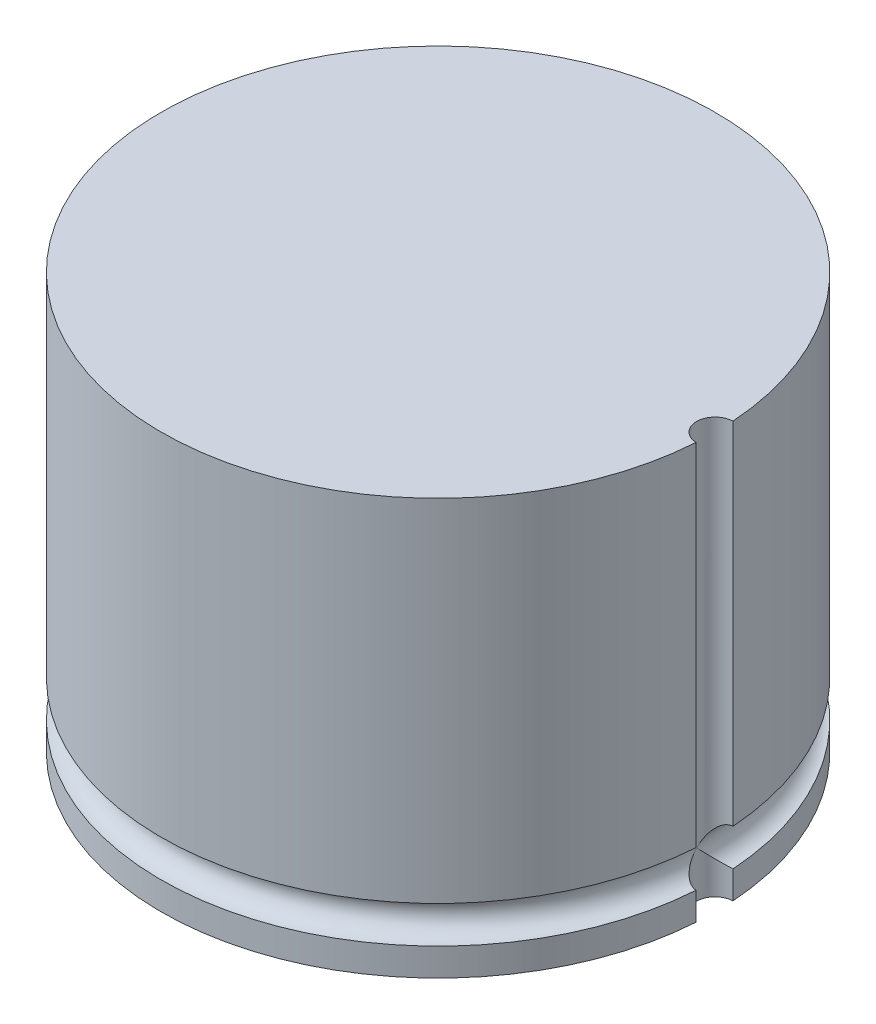
from build123d import *

# Parameters (mm, degrees)
SKETCH_2_R          = 30
EXTRUDE_1_DEPTH     = 45
SKETCH_3_R          = 2
SKETCH_4_R          = 1
EXTRUDE_2_DEPTH     = 6
SKETCH_5_R          = 2
CUT_EXTRUDE_1_DEPTH = 45


with BuildPart() as part:
    # Эскиз2 → Бобышка-Вытянуть1 (new body)
    with BuildSketch(Plane(origin=(0, 0, 0), x_dir=(1, 0, 0), z_dir=(0, 1, 0))):
        with Locations(Location((0, 0, 0), (0, 0, 90))):
            Circle(SKETCH_2_R)
    extrude(amount=EXTRUDE_1_DEPTH)

    # Эскиз3 → Вырез-Повернуть1 (revolve, cut)
    with BuildSketch(Plane(origin=(0, 0, 0), x_dir=(0, 0, -1), z_dir=(1, 0, 0)), mode=Mode.PRIVATE) as cut_revolve_1_sk:
        with Locations((-30, 5)):
            Circle(SKETCH_3_R)
    revolve(cut_revolve_1_sk.sketch.rotate(Axis((0, 0, 0), (0, 1, 0)), 180), axis=Axis((0, 0, 0), (0, 1, 0)), mode=Mode.SUBTRACT)

    # Эскиз4 → Бобышка-Вытянуть2 (add)
    with BuildSketch(Plane.XZ):
        with Locations(Location((5, 0, 0), (0, 0, 90))):
            Circle(SKETCH_4_R)
        with Locations(Location((-5, 0, 0), (0, 0, 90))):
            Circle(SKETCH_4_R)
    extrude(amount=EXTRUDE_2_DEPTH)

    # Эскиз5 → Вырез-Вытянуть1 (cut)
    with BuildSketch(Plane.XZ):
        with Locations((30, 0)):
            Circle(SKETCH_5_R)
    extrude(amount=-CUT_EXTRUDE_1_DEPTH, mode=Mode.SUBTRACT)


solid = part.part
